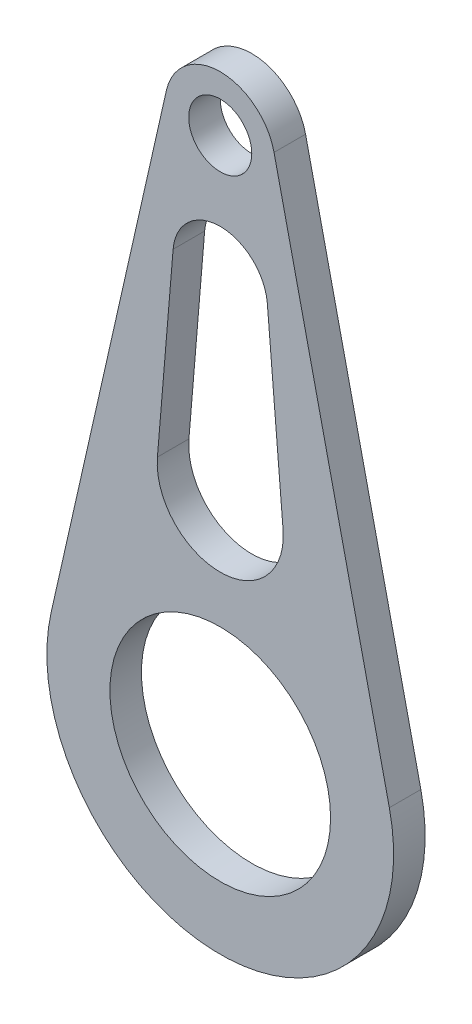
from build123d import *

# Parameters (mm, degrees)
SKETCH_1_R      = 7
SKETCH_1_R_2    = 2
EXTRUDE_1_DEPTH = 2


with BuildPart() as part:
    # 草图1 → 凸台-拉伸1 (new body)
    with BuildSketch(Plane.XY):
        with BuildLine():
            Line((-3.413784582, 34.772058824), (-10.729037258, 2.426470588))
            ThreePointArc((-10.729037258, 2.426470588), (0, -11), (10.729037258, 2.426470588))
            Line((10.729037258, 2.426470588), (3.413784582, 34.772058824))
            ThreePointArc((3.413784582, 34.772058824), (0, 37.5), (-3.413784582, 34.772058824))
        make_face()
        Circle(SKETCH_1_R, mode=Mode.SUBTRACT)
        with Locations((0, 34)):
            Circle(SKETCH_1_R_2, mode=Mode.SUBTRACT)
        with BuildLine():
            Line((-2.989565186, 26.25), (-3.986086914, 14.333333333))
            ThreePointArc((-3.986086914, 14.333333333), (0, 10), (3.986086914, 14.333333333))
            Line((3.986086914, 14.333333333), (2.989565186, 26.25))
            ThreePointArc((2.989565186, 26.25), (0, 29), (-2.989565186, 26.25))
        make_face(mode=Mode.SUBTRACT)
    extrude(amount=EXTRUDE_1_DEPTH)


solid = part.part
